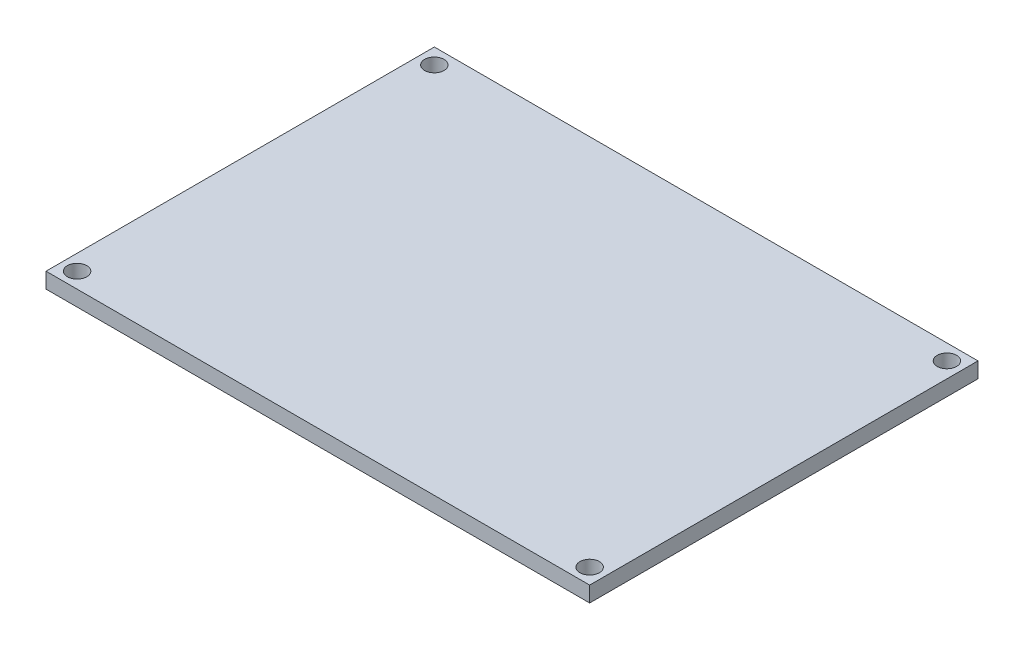
from build123d import *

# Parameters (mm, degrees)
SKETCH1_W               = 70
SKETCH1_H               = 50
BOSS_EXTRUDE1_DEPTH     = 2
CUT_EXTRUDE1_DEPTH      = 44.058100283
CUT_EXTRUDE1_DEPTH_BACK = 44.058100283
SKETCH2_R               = 1.25


with BuildPart() as part:
    # Sketch1 → Boss-Extrude1 (new body)
    with BuildSketch(Plane(origin=(0, 0, 0), x_dir=(1, 0, 0), z_dir=(0, 1, 0))):
        Rectangle(SKETCH1_W, SKETCH1_H)
    extrude(amount=BOSS_EXTRUDE1_DEPTH)

    # Sketch2 → Cut-Extrude1 (cut, two sides: drawn at the far end of the back side and taken through both)
    with BuildSketch(Plane.XZ.offset(-CUT_EXTRUDE1_DEPTH_BACK)):
        with Locations(Location((-33, 23, 0), (0, 0, 270))):
            Circle(SKETCH2_R)
        with Locations(Location((33, 23, 0), (0, 0, 270))):
            Circle(SKETCH2_R)
        with Locations(Location((33, -23, 0), (0, 0, 270))):
            Circle(SKETCH2_R)
        with Locations(Location((-33, -23, 0), (0, 0, 270))):
            Circle(SKETCH2_R)
    extrude(amount=CUT_EXTRUDE1_DEPTH + CUT_EXTRUDE1_DEPTH_BACK, mode=Mode.SUBTRACT)


solid = part.part
